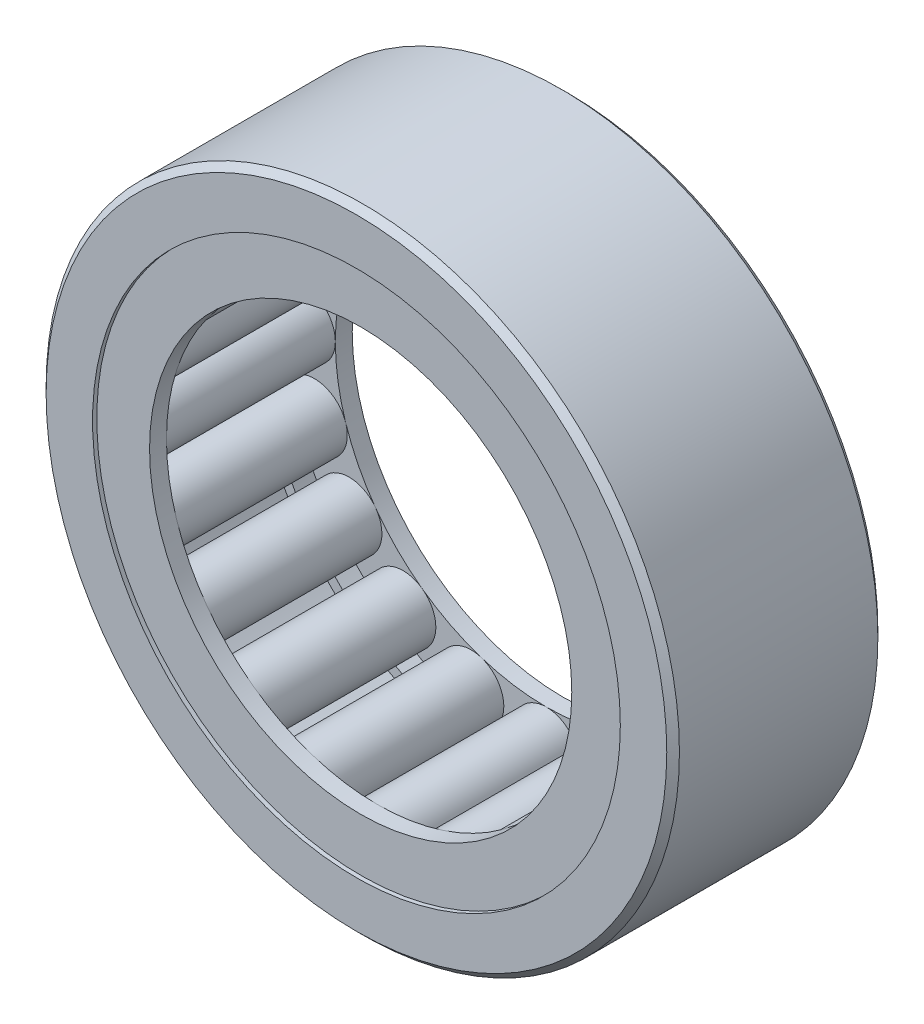
from build123d import *

# Parameters (mm, degrees)
CHAMFER1_SIZE       = 0.381
SKETCH2_R           = 1.9685
BOSS_EXTRUDE1_DEPTH = 5.08
CIRPATTERN1_COUNT   = 20
SKETCH3_R           = 15.875
SKETCH3_R_2         = 12.7
BOSS_EXTRUDE2_DEPTH = 1.016


with BuildPart() as part:
    # Sketch1 → Revolve1 (revolve)
    with BuildSketch(Plane(origin=(0, 0, 0), x_dir=(0, 0, -1), z_dir=(1, 0, 0)), mode=Mode.PRIVATE) as revolve1_sk:
        Polygon((-3.81, 16.51), (3.81, 16.51), (3.81, 15.875), (6.35, 15.875), (6.35, 19.05), (-6.35, 19.05), (-6.35, 15.875), (-3.81, 15.875), align=None)
    revolve(revolve1_sk.sketch.rotate(Axis((0, 0, 0), (0, 0, -1)), 90), axis=Axis((0, 0, 0), (0, 0, -1)))

    # Chamfer1
    chamfer1_edges = [part.edges().sort_by_distance(p)[0] for p in [
        (-19.05, 0, -6.35),
        (-19.05, 0, 6.35),
    ]]
    chamfer(chamfer1_edges, length=CHAMFER1_SIZE)

    # Sketch2 → Boss-Extrude1 (add, symmetric)
    with BuildSketch(Plane.XY):
        with Locations((0, 14.6685)):
            Circle(SKETCH2_R)
    boss_extrude1 = extrude(amount=BOSS_EXTRUDE1_DEPTH, both=True)

    # CirPattern1: Boss-Extrude1 ×20 about axis
    cirpattern1_axis = Axis((0, 0, 0), (0, 0, 1))
    for i in range(1, CIRPATTERN1_COUNT):
        add(boss_extrude1.rotate(cirpattern1_axis, i * 360 / CIRPATTERN1_COUNT))

    # Sketch3 → Boss-Extrude2 (add)
    with BuildSketch(Plane.XY.offset(5.08)):
        Circle(SKETCH3_R)
        Circle(SKETCH3_R_2, mode=Mode.SUBTRACT)
    boss_extrude2 = extrude(amount=BOSS_EXTRUDE2_DEPTH)

    # Mirror1: Boss-Extrude2 across plane
    add(boss_extrude2.mirror(Plane.XY))


solid = part.part
